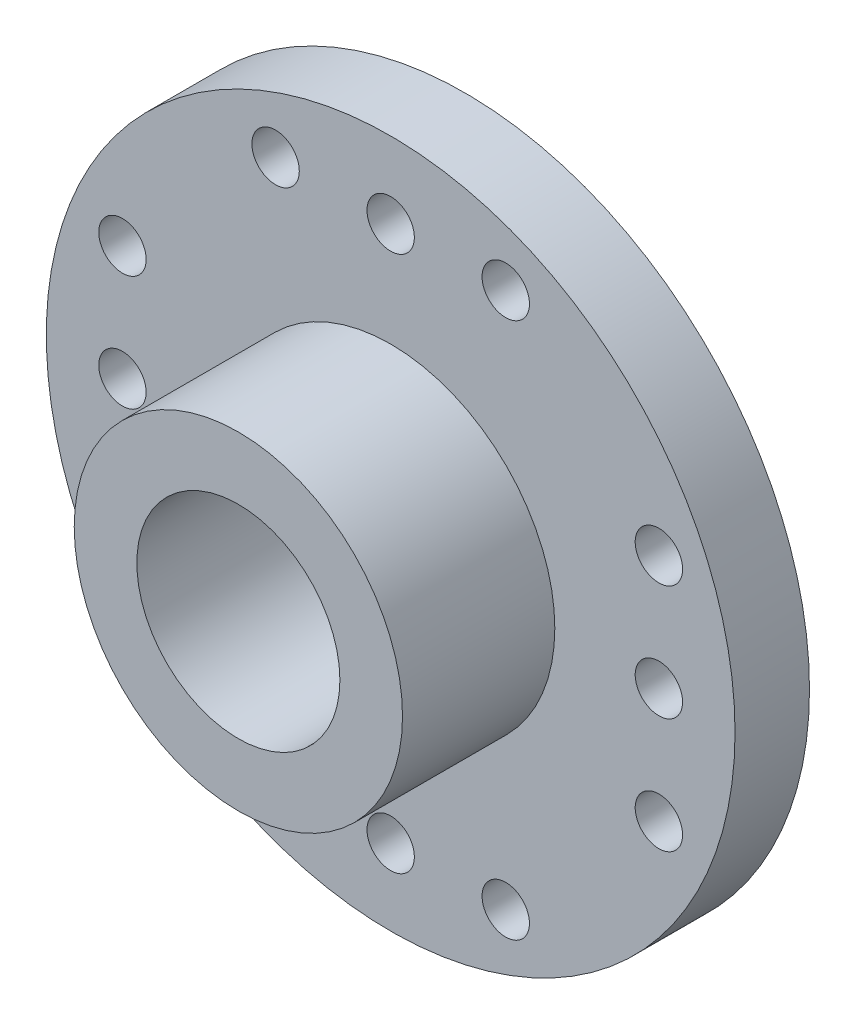
from build123d import *

# Parameters (mm, degrees)
SKETCH_1_R      = 10.175
SKETCH_1_R_2    = 1.375
SKETCH_1_R_3    = 0.7
EXTRUDE_1_DEPTH = 2.2
SKETCH_2_R      = 4.85
SKETCH_2_R_2    = 3
EXTRUDE_2_DEPTH = 4.5


with BuildPart() as part:
    # 草圖1 → 填料-伸長1 (new body)
    with BuildSketch(Plane.XY):
        Circle(SKETCH_1_R)
        Circle(SKETCH_1_R_2, mode=Mode.SUBTRACT)
        with Locations((7.925, 0)):
            Circle(SKETCH_1_R_3, mode=Mode.SUBTRACT)
        with Locations((7.925, 3.4)):
            Circle(SKETCH_1_R_3, mode=Mode.SUBTRACT)
        with Locations((7.925, -3.4)):
            Circle(SKETCH_1_R_3, mode=Mode.SUBTRACT)
        with Locations((-7.925, 0)):
            Circle(SKETCH_1_R_3, mode=Mode.SUBTRACT)
        with Locations((-7.925, 3.4)):
            Circle(SKETCH_1_R_3, mode=Mode.SUBTRACT)
        with Locations((-7.925, -3.4)):
            Circle(SKETCH_1_R_3, mode=Mode.SUBTRACT)
        with Locations((0, -7.925)):
            Circle(SKETCH_1_R_3, mode=Mode.SUBTRACT)
        with Locations((-3.4, -7.925)):
            Circle(SKETCH_1_R_3, mode=Mode.SUBTRACT)
        with Locations((3.4, -7.925)):
            Circle(SKETCH_1_R_3, mode=Mode.SUBTRACT)
        with Locations((0, 7.925)):
            Circle(SKETCH_1_R_3, mode=Mode.SUBTRACT)
        with Locations((3.4, 7.925)):
            Circle(SKETCH_1_R_3, mode=Mode.SUBTRACT)
        with Locations((-3.4, 7.925)):
            Circle(SKETCH_1_R_3, mode=Mode.SUBTRACT)
    extrude(amount=EXTRUDE_1_DEPTH)

    # 草圖2 → 填料-伸長2 (add)
    with BuildSketch(Plane.XY.offset(2.2)):
        Circle(SKETCH_2_R)
        Circle(SKETCH_2_R_2, mode=Mode.SUBTRACT)
    extrude(amount=EXTRUDE_2_DEPTH)


solid = part.part
